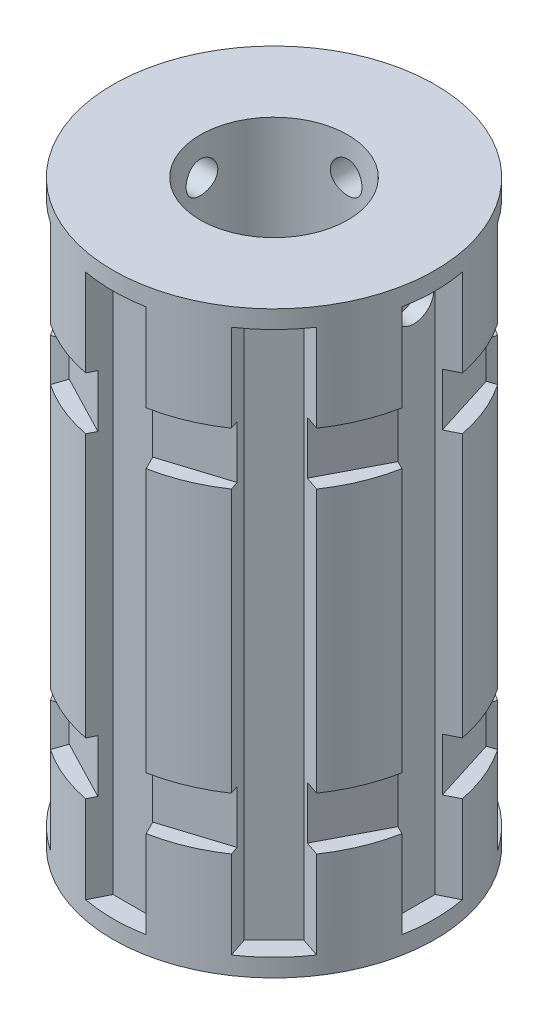
from build123d import *

# Parameters (mm, degrees)
SKETCH1_R           = 15.2785
BOSS_EXTRUDE1_DEPTH = 55
CUT_EXTRUDE2_DEPTH  = 25.8
CIRPATTERN1_COUNT   = 8
SKETCH5_R           = 7.005
CUT_EXTRUDE3_DEPTH  = 60.092005589
SKETCH7_W           = 5
SKETCH7_H           = 1.5
CUT_EXTRUDE4_DEPTH  = 60.092005589
CIRPATTERN2_COUNT   = 8
SKETCH8_R           = 1.9
CUT_EXTRUDE5_DEPTH  = 1.5
CIRPATTERN3_COUNT   = 2
SKETCH9_R           = 1.9
CUT_EXTRUDE6_DEPTH  = 1.5
SKETCH10_R          = 1.505
CUT_EXTRUDE7_DEPTH  = 64.17051378
SKETCH11_R          = 1.505
CUT_EXTRUDE8_DEPTH  = 8


with BuildPart() as part:
    # Sketch1 → Boss-Extrude1 (new body)
    with BuildSketch(Plane(origin=(0, 0, 0), x_dir=(1, 0, 0), z_dir=(0, 1, 0))):
        with Locations(Location((0, 0, 0), (0, 0, 270))):
            Circle(SKETCH1_R)
        with BuildLine():
            Line((1.91637679, 2.5), (-1.91637679, 2.5))
            ThreePointArc((-1.91637679, 2.5), (0, -3.15), (1.91637679, 2.5))
        make_face(mode=Mode.SUBTRACT)
    extrude(amount=BOSS_EXTRUDE1_DEPTH)

    # Sketch3 → Cut-Extrude2 (cut, symmetric)
    with BuildSketch(Plane(origin=(0, 27.5, 0), x_dir=(-1, 0, 0), z_dir=(0, -1, 0))):
        Polygon((-2, 13.2785), (2, 13.2785), (3, 15.2785), (-3, 15.2785), align=None)
    cut_extrude2 = extrude(amount=CUT_EXTRUDE2_DEPTH, both=True, mode=Mode.SUBTRACT)

    # CirPattern1: Cut-Extrude2 ×8 about axis
    cirpattern1_axis = Axis((0, 0, 0), (0, 1, 0))
    for i in range(1, CIRPATTERN1_COUNT):
        add(cut_extrude2.rotate(cirpattern1_axis, i * 360 / CIRPATTERN1_COUNT), mode=Mode.SUBTRACT)

    # Sketch5 → Cut-Extrude3 (cut, through all)
    with BuildSketch(Plane(origin=(0, 55, 0), x_dir=(1, 0, 0), z_dir=(0, 1, 0))):
        with Locations(Location((0, 0, 0), (0, 0, 270))):
            Circle(SKETCH5_R)
    extrude(amount=-CUT_EXTRUDE3_DEPTH, mode=Mode.SUBTRACT)

    # Sketch7 → Cut-Extrude4 (cut, symmetric)
    with BuildSketch(Plane(origin=(0, 0, 0), x_dir=(0, -1, 0), z_dir=(0.8870108331782212, 0, 0.46174861323503485))):
        with Locations((-12.5, 14.5285)):
            Rectangle(SKETCH7_W, SKETCH7_H)
        with Locations((-42.5, 14.5285)):
            Rectangle(SKETCH7_W, SKETCH7_H)
    cut_extrude4 = extrude(amount=CUT_EXTRUDE4_DEPTH, both=True, mode=Mode.SUBTRACT)

    # CirPattern2: Cut-Extrude4 ×8 about axis
    cirpattern2_axis = Axis((0, 0, 0), (0, 1, 0))
    for i in range(1, CIRPATTERN2_COUNT):
        add(cut_extrude4.rotate(cirpattern2_axis, i * 360 / CIRPATTERN2_COUNT), mode=Mode.SUBTRACT)

    # Sketch8 → Cut-Extrude5 (cut)
    with BuildSketch(Plane(origin=(13.2785, 0, 0), x_dir=(0, 0, -1), z_dir=(1, 0, 0))):
        with Locations((0, 51.5)):
            Circle(SKETCH8_R)
    cut_extrude5 = extrude(amount=-CUT_EXTRUDE5_DEPTH, mode=Mode.SUBTRACT)

    # CirPattern3: Cut-Extrude5 ×2 about axis
    cirpattern3_axis = Axis((0, 119.409259796, 0), (0, -1, 0))
    for i in range(1, CIRPATTERN3_COUNT):
        add(cut_extrude5.rotate(cirpattern3_axis, i * 360 / CIRPATTERN3_COUNT), mode=Mode.SUBTRACT)

    # Sketch9 → Cut-Extrude6 (cut)
    with BuildSketch(Plane(origin=(0, 0, -13.2785), x_dir=(-1, 0, 0), z_dir=(0, 0, -1))):
        with Locations((0, 51.5)):
            Circle(SKETCH9_R)
    extrude(amount=-CUT_EXTRUDE6_DEPTH, mode=Mode.SUBTRACT)

    # Sketch10 → Cut-Extrude7 (cut, through all)
    with BuildSketch(Plane(origin=(11.7785, 0, 0), x_dir=(0, 0, -1), z_dir=(1, 0, 0))):
        with Locations((0, 51.5)):
            Circle(SKETCH10_R)
    extrude(amount=-CUT_EXTRUDE7_DEPTH, mode=Mode.SUBTRACT)

    # Sketch11 → Cut-Extrude8 (cut)
    with BuildSketch(Plane(origin=(0, 0, -11.7785), x_dir=(-1, 0, 0), z_dir=(0, 0, -1))):
        with Locations((0, 51.5)):
            Circle(SKETCH11_R)
    extrude(amount=-CUT_EXTRUDE8_DEPTH, mode=Mode.SUBTRACT)


solid = part.part
